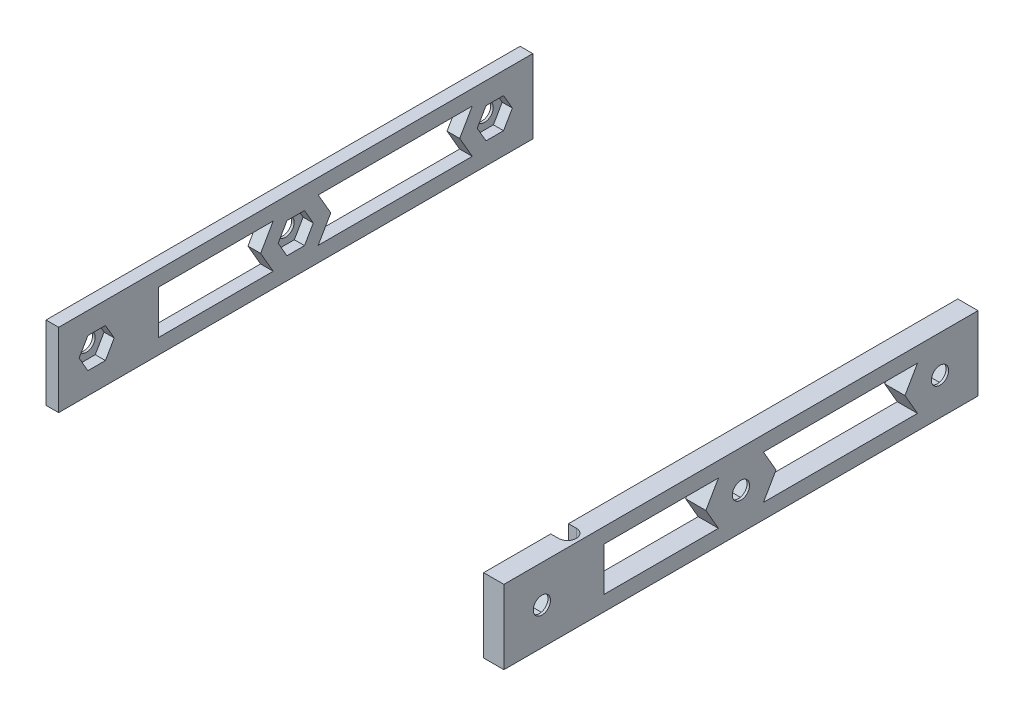
from build123d import *

# Parameters (mm, degrees)
SKETCH1_W                     = 2.5
SKETCH1_H                     = 93.6
BOSS_EXTRUDE1_DEPTH           = 14.6
SKETCH1_W_2                   = 4
BOSS_EXTRUDE1_2_DEPTH         = 14.6
CUT_EXTRUDE1_DEPTH            = 67.681631654
SKETCH7_W                     = 1.7
SKETCH7_H                     = 90.4
M3_CLEARANCE_HOLE1_AT_2_COUNT = 2
M3_CLEARANCE_HOLE1_AT_2_PITCH = 39.3
M3_CLEARANCE_HOLE1_AT_3_COUNT = 2
M3_CLEARANCE_HOLE1_AT_3_PITCH = 39.3
CUT_EXTRUDE2_DEPTH            = 3.5
CUT_EXTRUDE4_DEPTH            = 100.339619488
CUT_EXTRUDE4_DEPTH_BACK       = 100.339619488


with BuildPart() as part:
    # Sketch1 → Boss-Extrude1 (new body)
    with BuildSketch(Plane(origin=(0, 0, 0), x_dir=(1, 0, 0), z_dir=(0, 1, 0))):
        with Locations((-43.95, 0)):
            Rectangle(SKETCH1_W, SKETCH1_H)
    extrude(amount=BOSS_EXTRUDE1_DEPTH)


with BuildPart() as body_2:
    # Sketch1 → Boss-Extrude1 2 (new body)
    with BuildSketch(Plane(origin=(0, 0, 0), x_dir=(1, 0, 0), z_dir=(0, 1, 0))):
        with Locations((43.2, 0)):
            Rectangle(SKETCH1_W_2, SKETCH1_H)
    extrude(amount=BOSS_EXTRUDE1_2_DEPTH)

    # Sketch4 → Cut-Extrude1 (cut, through all)
    with BuildSketch(Plane(origin=(0, 14.6, 0), x_dir=(1, 0, 0), z_dir=(0, 1, 0))):
        with BuildLine():
            Line((42.75, -30.05), (42.75, -31.8))
            Line((42.75, -31.8), (42.75, -33.55))
            ThreePointArc((42.75, -33.55), (43.987436867, -33.037436867), (44.5, -31.8))
            ThreePointArc((44.5, -31.8), (43.987436867, -30.562563133), (42.75, -30.05))
        make_face()
        with BuildLine():
            Line((42.75, -33.55), (42.75, -31.8))
            Line((42.75, -31.8), (42.75, -30.05))
            ThreePointArc((42.75, -30.05), (41.844242505, -30.302634527), (41.2, -30.98759616))
            Line((41.2, -30.98759616), (41.2, -32.61240384))
            ThreePointArc((41.2, -32.61240384), (41.844242505, -33.297365473), (42.75, -33.55))
        make_face()
        with BuildLine():
            Line((41.2, -33.55), (42.75, -33.55))
            ThreePointArc((42.75, -33.55), (41.844242505, -33.297365473), (41.2, -32.61240384))
            Line((41.2, -32.61240384), (41.2, -33.55))
        make_face()
        with BuildLine():
            ThreePointArc((41.2, -30.98759616), (41.844242505, -30.302634527), (42.75, -30.05))
            Line((42.75, -30.05), (41.2, -30.05))
            Line((41.2, -30.05), (41.2, -30.98759616))
        make_face()
    extrude(amount=-CUT_EXTRUDE1_DEPTH, mode=Mode.SUBTRACT)


with BuildPart() as m3_clearance_hole1_tool:
    # Sketch7 → M3 Clearance Hole1 (revolve)
    with BuildSketch(Plane(origin=(45.2, 7.3, 0), x_dir=(0, 0, -1), z_dir=(0, 1, 0))):
        with Locations((0.85, 45.2)):
            Rectangle(SKETCH7_W, SKETCH7_H)
    m3_clearance_hole1 = revolve(axis=Axis((51.55, 7.3, 0), (-1, 0, 0)))


with BuildPart() as part_1:
    add(part.part)

    # M3 Clearance Hole1: cut by m3_clearance_hole1_tool
    add(m3_clearance_hole1_tool.part, mode=Mode.SUBTRACT)


with BuildPart() as body_2_1:
    add(body_2.part)

    # M3 Clearance Hole1: cut by m3_clearance_hole1_tool
    add(m3_clearance_hole1_tool.part, mode=Mode.SUBTRACT)


with BuildPart() as m3_clearance_hole1_at_2_tool:
    # M3 Clearance Hole1 at 2: M3 Clearance Hole1 ×2
    with Locations(*[(0, 0, i * M3_CLEARANCE_HOLE1_AT_2_PITCH) for i in range(1, M3_CLEARANCE_HOLE1_AT_2_COUNT)]):
        add(m3_clearance_hole1)


with BuildPart() as part_2:
    add(part_1.part)

    # M3 Clearance Hole1 at 2: cut by m3_clearance_hole1_at_2_tool
    add(m3_clearance_hole1_at_2_tool.part, mode=Mode.SUBTRACT)


with BuildPart() as body_2_2:
    add(body_2_1.part)

    # M3 Clearance Hole1 at 2: cut by m3_clearance_hole1_at_2_tool
    add(m3_clearance_hole1_at_2_tool.part, mode=Mode.SUBTRACT)


with BuildPart() as m3_clearance_hole1_at_3_tool:
    # M3 Clearance Hole1 at 3: M3 Clearance Hole1 ×2
    with Locations(*[(0, 0, -i * M3_CLEARANCE_HOLE1_AT_3_PITCH) for i in range(1, M3_CLEARANCE_HOLE1_AT_3_COUNT)]):
        add(m3_clearance_hole1)


with BuildPart() as part_3:
    add(part_2.part)

    # M3 Clearance Hole1 at 3: cut by m3_clearance_hole1_at_3_tool
    add(m3_clearance_hole1_at_3_tool.part, mode=Mode.SUBTRACT)


with BuildPart() as body_2_3:
    add(body_2_2.part)

    # M3 Clearance Hole1 at 3: cut by m3_clearance_hole1_at_3_tool
    add(m3_clearance_hole1_at_3_tool.part, mode=Mode.SUBTRACT)

    # Sketch8 → Cut-Extrude2 (cut)
    with BuildSketch(Plane.ZY.offset(-41.2)):
        Polygon((-35.835898385, 7.3), (-37.567949192, 10.3), (-41.032050808, 10.3), (-42.764101615, 7.3), (-41.032050808, 4.3), (-37.567949192, 4.3), align=None)
        Polygon((3.464101615, 7.3), (1.732050808, 10.3), (-1.732050808, 10.3), (-3.464101615, 7.3), (-1.732050808, 4.3), (1.732050808, 4.3), align=None)
        Polygon((42.764101615, 7.3), (41.032050808, 10.3), (37.567949192, 10.3), (35.835898385, 7.3), (37.567949192, 4.3), (41.032050808, 4.3), align=None)
    cut_extrude2 = extrude(amount=-CUT_EXTRUDE2_DEPTH, mode=Mode.SUBTRACT)


with BuildPart() as part_4:
    add(part_3.part)

    # Mirror1: Cut-Extrude2 across plane
    add(cut_extrude2.mirror(Plane(origin=(0, 0, 0), x_dir=(0, 0, 1), z_dir=(1, 0, 0))), mode=Mode.SUBTRACT)


with BuildPart() as cut_extrude4_tool:
    # Sketch14 → Cut-Extrude4 (new, two sides: drawn at the far end of the back side and taken through both)
    with BuildSketch(Plane.ZY.offset(-41.2).offset(-CUT_EXTRUDE4_DEPTH_BACK)):
        Polygon((-34.854402927, 3), (-4.445597073, 3), (-6.92820323, 7.3), (-4.445597073, 11.6), (-34.854402927, 11.6), (-32.37179677, 7.3), align=None)
        Polygon((4.445597073, 3), (27.05, 3), (27.05, 11.6), (4.445597073, 11.6), (6.92820323, 7.3), align=None)
    extrude(amount=CUT_EXTRUDE4_DEPTH + CUT_EXTRUDE4_DEPTH_BACK)


with BuildPart() as part_5:
    add(part_4.part)

    # Cut-Extrude4: cut by cut_extrude4_tool
    add(cut_extrude4_tool.part, mode=Mode.SUBTRACT)


with BuildPart() as body_2_4:
    add(body_2_3.part)

    # Cut-Extrude4: cut by cut_extrude4_tool
    add(cut_extrude4_tool.part, mode=Mode.SUBTRACT)


solid = Compound([part_5.part, body_2_4.part])
